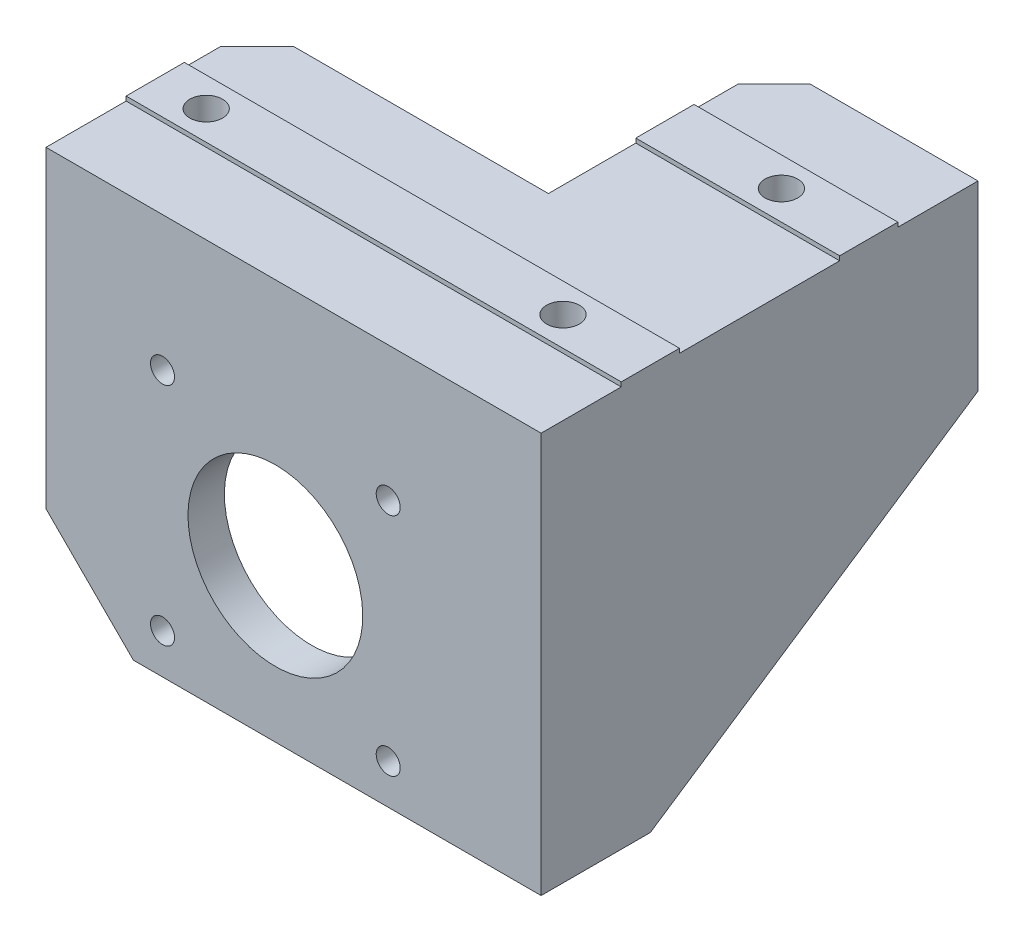
from build123d import *

# Parameters (mm, degrees)
BOSS_EXTRUDE1_DEPTH                                 = 31.5
SKETCH2_R                                           = 12
SKETCH2_R_2                                         = 1.65
CUT_EXTRUDE1_DEPTH                                  = 77.591448609
SKETCH3_W                                           = 40
SKETCH3_H                                           = 31
CUT_EXTRUDE2_DEPTH                                  = 81.257398413
BOSS_EXTRUDE2_DEPTH                                 = 5
SKETCH8_W                                           = 68
SKETCH8_H                                           = 8
SKETCH8_W_2                                         = 28
BOSS_EXTRUDE3_DEPTH                                 = 0.6
CBORE_FOR_M4_HEX_SOCKET_HEAD_CAP_SCREW1_D           = 4.5
CBORE_FOR_M4_HEX_SOCKET_HEAD_CAP_SCREW1_CBORE_D     = 10
CBORE_FOR_M4_HEX_SOCKET_HEAD_CAP_SCREW1_CBORE_DEPTH = 8
CHAMFER1_SIZE                                       = 12
CHAMFER2_SIZE                                       = 5


with BuildPart() as part:
    # Sketch1 → Boss-Extrude1 (new, symmetric)
    with BuildSketch(Plane(origin=(0, 0, 0), x_dir=(0, 0, -1), z_dir=(1, 0, 0))):
        Polygon((-55, 0), (0, 0), (0, 12), (-60, 12), (-60, -43), (-55, -43), align=None)
    extrude(amount=BOSS_EXTRUDE1_DEPTH, both=True)

    # Sketch2 → Cut-Extrude1 (cut, through all)
    with BuildSketch(Plane(origin=(0, 0, 55), x_dir=(-1, 0, 0), z_dir=(0, 0, -1))):
        with Locations(Location((0, -22, 0), (0, 0, 90))):
            Circle(SKETCH2_R)
        with Locations(Location((-15.5, -6.5, 0), (0, 0, 90))):
            Circle(SKETCH2_R_2)
        with Locations(Location((-15.5, -37.5, 0), (0, 0, 90))):
            Circle(SKETCH2_R_2)
        with Locations(Location((15.5, -37.5, 0), (0, 0, 90))):
            Circle(SKETCH2_R_2)
        with Locations(Location((15.5, -6.5, 0), (0, 0, 90))):
            Circle(SKETCH2_R_2)
    extrude(amount=-CUT_EXTRUDE1_DEPTH, mode=Mode.SUBTRACT)

    # Sketch3 → Cut-Extrude2 (cut, through all)
    with BuildSketch(Plane.XZ):
        with Locations((-11.5, 15.5)):
            Rectangle(SKETCH3_W, SKETCH3_H)
    extrude(amount=-CUT_EXTRUDE2_DEPTH, mode=Mode.SUBTRACT)

    # Sketch7 → Boss-Extrude2 (add)
    with BuildSketch(Plane(origin=(31.5, 0, 0), x_dir=(0, 0, -1), z_dir=(1, 0, 0))):
        Polygon((-60, -43), (-45, -43), (0, -13), (0, 12), (-60, 12), align=None)
    extrude(amount=BOSS_EXTRUDE2_DEPTH)

    # Sketch8 → Boss-Extrude3 (add)
    with BuildSketch(Plane(origin=(0, 12, 0), x_dir=(1, 0, 0), z_dir=(0, 1, 0))):
        with Locations((2.5, -45)):
            Rectangle(SKETCH8_W, SKETCH8_H)
        with Locations((22.5, -15)):
            Rectangle(SKETCH8_W_2, SKETCH8_H)
    extrude(amount=BOSS_EXTRUDE3_DEPTH)

    # CBORE for M4 Hex Socket Head Cap Screw1 (through all)
    with Locations(Plane(origin=(0, 0, 0), x_dir=(-1, 0, 0), z_dir=(0, -1, 0))):
        with Locations((24.5, -45), (-24.5, -45), (-24.5, -15)):
            CounterBoreHole(CBORE_FOR_M4_HEX_SOCKET_HEAD_CAP_SCREW1_D / 2, CBORE_FOR_M4_HEX_SOCKET_HEAD_CAP_SCREW1_CBORE_D / 2, CBORE_FOR_M4_HEX_SOCKET_HEAD_CAP_SCREW1_CBORE_DEPTH)

    # Chamfer1
    chamfer1_edges = [part.edges().sort_by_distance(p)[0] for p in [
        (-31.5, -43, 57.5),
    ]]
    chamfer(chamfer1_edges, length=CHAMFER1_SIZE)

    # Chamfer2
    chamfer2_edges = [part.edges().sort_by_distance(p)[0] for p in [
        (-31.5, 6, 31),
        (8.5, 6, 0),
    ]]
    chamfer(chamfer2_edges, length=CHAMFER2_SIZE)


solid = part.part
